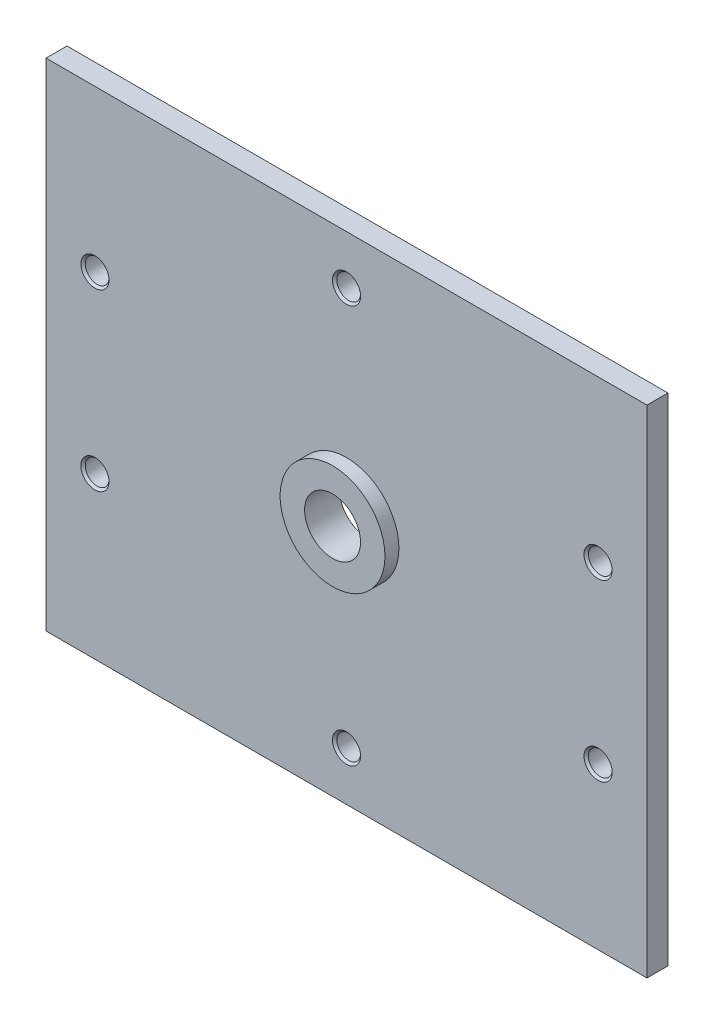
from build123d import *

# Parameters (mm, degrees)
SKETCH_1_W                   = 172
SKETCH_1_H                   = 142
EXTRUDE_1_DEPTH              = 6
HOLE_WIZARD_M8_1_D           = 6.8
HOLE_WIZARD_M8_1_DEPTH       = 6
HOLE_WIZARD_M8_1_CSINK_D     = 8.05
HOLE_WIZARD_M8_1_CSINK_ANGLE = 90
HOLE_WIZARD_M8_1_TIP         = 2.042926105
SKETCH_11_R                  = 15
EXTRUDE_3_DEPTH              = 4
SKETCH_12_R                  = 8
CUT_EXTRUDE_1_DEPTH          = 224.266656713


with BuildPart() as part:
    # 草图1 → 凸台-拉伸1 (new body)
    with BuildSketch(Plane.XY):
        with Locations((86, -71)):
            Rectangle(SKETCH_1_W, SKETCH_1_H)
    extrude(amount=EXTRUDE_1_DEPTH)

    # M8 螺纹孔1
    with Locations(Plane.XY.offset(6)):
        with Locations((14, -46), (14, -96), (86, -14), (86, -128), (158, -96), (158, -46)):
            CounterSinkHole(HOLE_WIZARD_M8_1_D / 2, HOLE_WIZARD_M8_1_CSINK_D / 2, depth=HOLE_WIZARD_M8_1_DEPTH, counter_sink_angle=HOLE_WIZARD_M8_1_CSINK_ANGLE)
            with Locations((0, 0, -(HOLE_WIZARD_M8_1_DEPTH + HOLE_WIZARD_M8_1_TIP / 2))):  # 118° drill point
                Cone(0, HOLE_WIZARD_M8_1_D / 2, HOLE_WIZARD_M8_1_TIP, mode=Mode.SUBTRACT)

    # 草图11 → 凸台-拉伸3 (add)
    with BuildSketch(Plane.XY.offset(6)):
        with Locations((86, -71)):
            Circle(SKETCH_11_R)
    extrude(amount=EXTRUDE_3_DEPTH)

    # 草图12 → 切除-拉伸1 (cut, through all)
    with BuildSketch(Plane.XY.offset(10)):
        with Locations((86, -71)):
            Circle(SKETCH_12_R)
    extrude(amount=-CUT_EXTRUDE_1_DEPTH, mode=Mode.SUBTRACT)


solid = part.part
